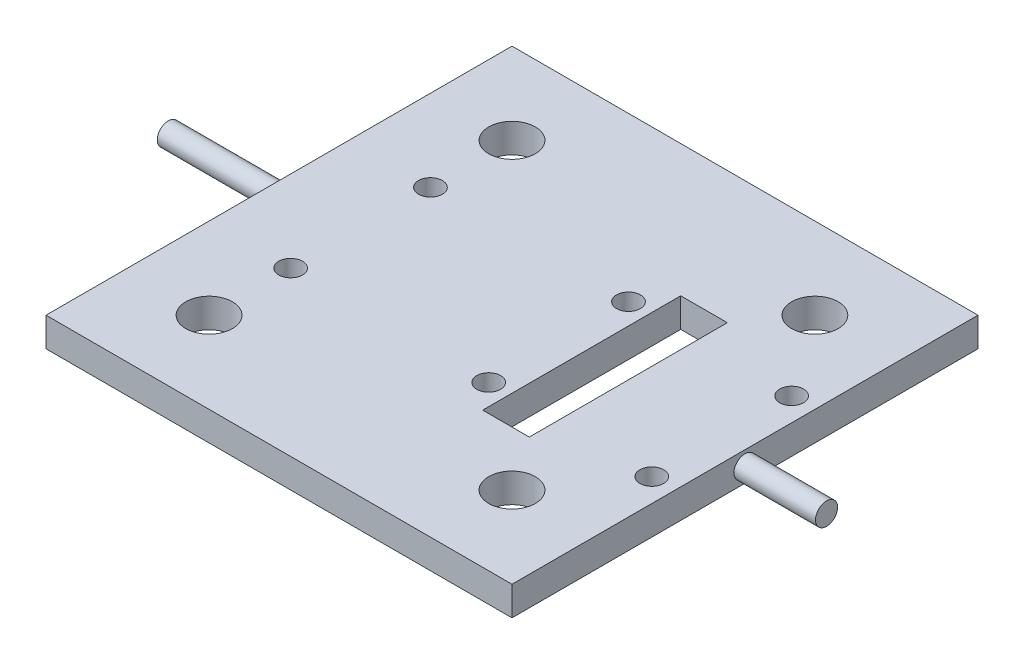
from build123d import *

# Parameters (mm, degrees)
SKETCH1_W            = 50.8
SKETCH1_H            = 50.8
BOSS_EXTRUDE1_DEPTH  = 1.5875
SKETCH3_R            = 1.2065
BOSS_EXTRUDE2_DEPTH  = 8.89
SKETCH4_R            = 2.54
CUT_EXTRUDE1_DEPTH   = 43.790708396
BOSS_EXTRUDE3_START  = 12.065
SKETCH5_R            = 1.2065
BOSS_EXTRUDE3_DEPTH  = 12.065
M2_CLEARANCE_HOLE1_D = 2.6
CUT_EXTRUDE2_REACH   = 47.375
SKETCH8_W            = 5.08
SKETCH8_H            = 21.59


with BuildPart() as part:
    # Sketch1 → Boss-Extrude1 (new, symmetric)
    with BuildSketch(Plane(origin=(0, 0, 0), x_dir=(1, 0, 0), z_dir=(0, 1, 0))):
        Rectangle(SKETCH1_W, SKETCH1_H)
    extrude(amount=BOSS_EXTRUDE1_DEPTH, both=True)

    # Sketch3 → Boss-Extrude2 (add)
    with BuildSketch(Plane(origin=(25.4, 0, 0), x_dir=(0, 0, -1), z_dir=(1, 0, 0))):
        with Locations(Location((0, 0, 0), (0, 0, 180))):
            Circle(SKETCH3_R)
    extrude(amount=BOSS_EXTRUDE2_DEPTH)

    # Sketch4 → Cut-Extrude1 (cut, through all)
    with BuildSketch(Plane(origin=(0, 1.5875, 0), x_dir=(1, 0, 0), z_dir=(0, 1, 0))):
        with Locations(Location((-16.51, 16.51, 0), (0, 0, 270))):
            Circle(SKETCH4_R)
        with Locations(Location((16.51, 16.51, 0), (0, 0, 270))):
            Circle(SKETCH4_R)
        with Locations(Location((16.51, -16.51, 0), (0, 0, 270))):
            Circle(SKETCH4_R)
        with Locations(Location((-16.51, -16.51, 0), (0, 0, 270))):
            Circle(SKETCH4_R)
    extrude(amount=-CUT_EXTRUDE1_DEPTH, mode=Mode.SUBTRACT)

    # Sketch5 → Boss-Extrude3 (add)
    with BuildSketch(Plane.ZY.offset(25.4).offset(BOSS_EXTRUDE3_START)):
        Circle(SKETCH5_R)
    extrude(amount=-BOSS_EXTRUDE3_DEPTH)

    # M2 Clearance Hole1 (through all)
    with Locations(Plane(origin=(0, 1.5875, 0), x_dir=(1, 0, 0), z_dir=(0, 1, 0))):
        with Locations((-16.51, -7.62), (-16.51, 7.62), (5.08, -7.62), (5.08, 7.62), (22.86, 7.62), (22.86, -7.62)):
            Hole(M2_CLEARANCE_HOLE1_D / 2)

    # Sketch8 → Cut-Extrude2 (cut, up to next)
    with BuildSketch(Plane(origin=(0, 1.5875, 0), x_dir=(1, 0, 0), z_dir=(0, 1, 0)), mode=Mode.PRIVATE) as cut_extrude2_sk1:
        with Locations((9.906, 0.232205857)):
            Rectangle(SKETCH8_W, SKETCH8_H)
    cut_extrude2_tool1 = extrude(cut_extrude2_sk1.sketch, amount=-CUT_EXTRUDE2_REACH, mode=Mode.PRIVATE) & part.part
    add(cut_extrude2_tool1.solids().sort_by_distance((9.906, 1.5875, -0.232206))[0], mode=Mode.SUBTRACT)


solid = part.part
